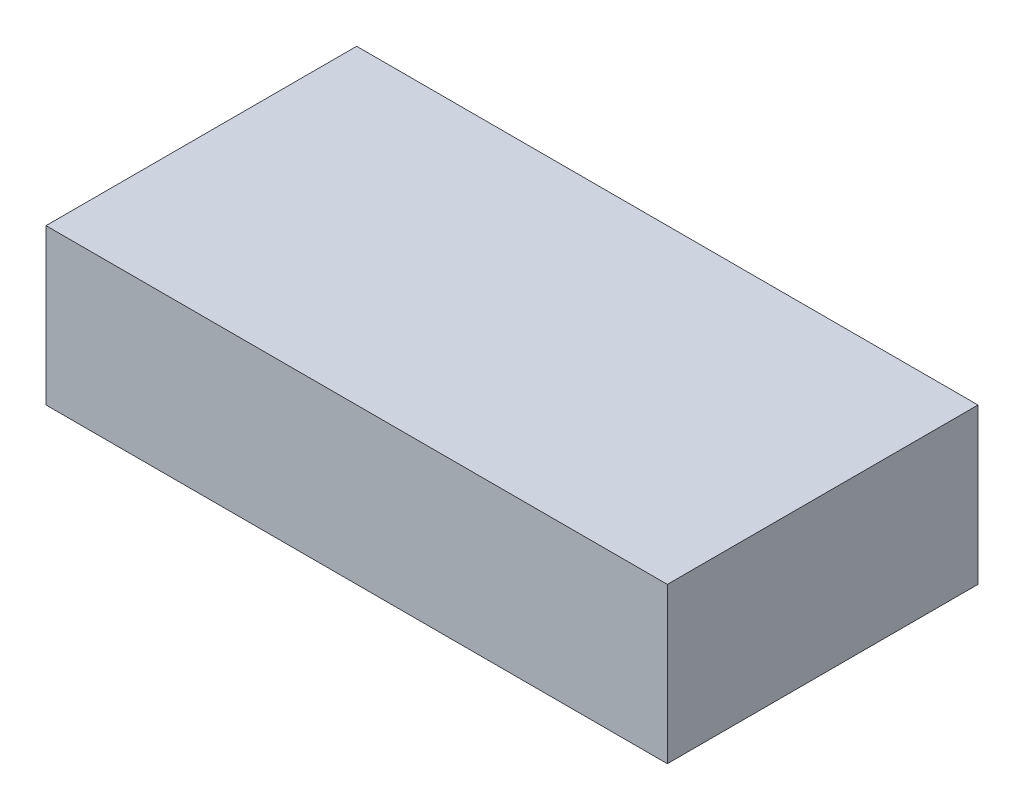
from build123d import *

# Parameters (mm, degrees)
SKETCH_1_W      = 20
SKETCH_1_H      = 5
EXTRUDE_1_DEPTH = 10


with BuildPart() as part:
    # 스케치1 → 보스-돌출1 (new body)
    with BuildSketch(Plane.XY):
        Rectangle(SKETCH_1_W, SKETCH_1_H)
    extrude(amount=EXTRUDE_1_DEPTH)


solid = part.part
